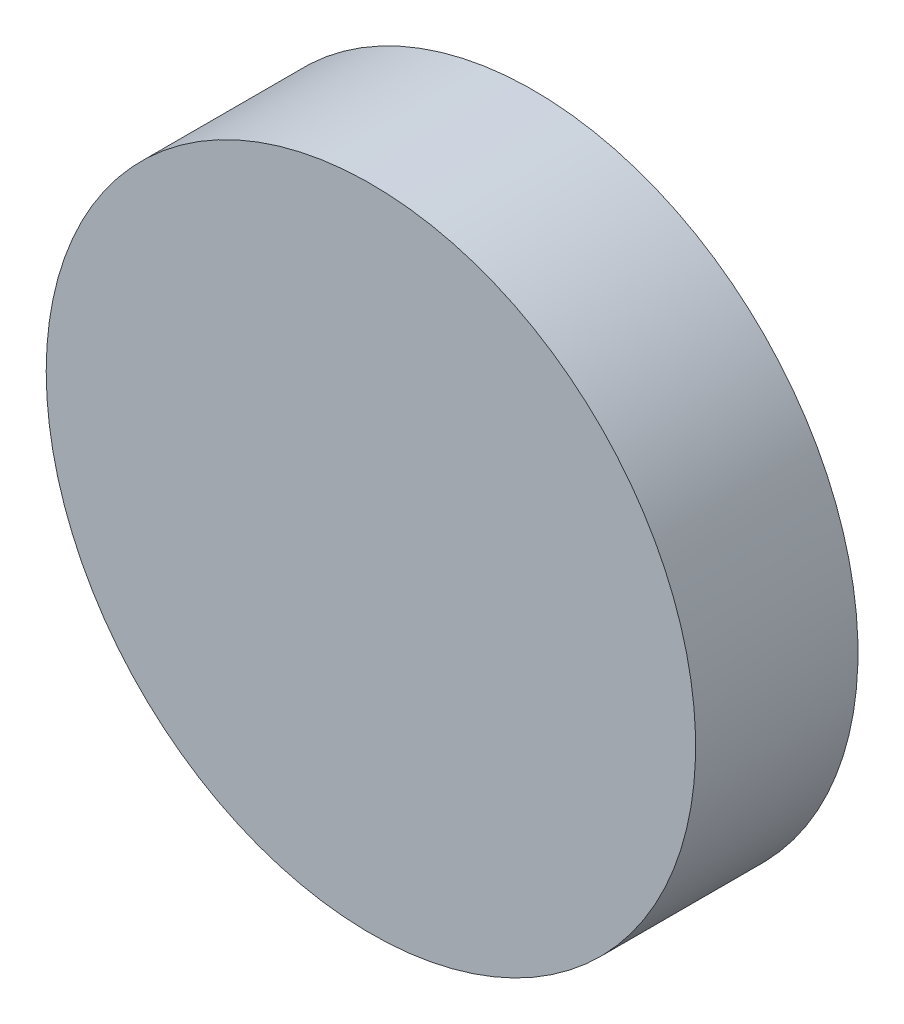
from build123d import *


with BuildPart() as part:
    # Sketch2 → Revolve1 (revolve)
    with BuildSketch(Plane(origin=(0, 0, 0), x_dir=(0, 0, -1), z_dir=(1, 0, 0)), mode=Mode.PRIVATE) as revolve1_sk:
        Polygon((0, 2), (1, 2), (1, 0.875), (0.5, 0.875), (0.5, 0), (0, 0), align=None)
    revolve(revolve1_sk.sketch.rotate(Axis((0, 0, -0.5), (0, 0, 1)), 90), axis=Axis((0, 0, -0.5), (0, 0, 1)))


solid = part.part
